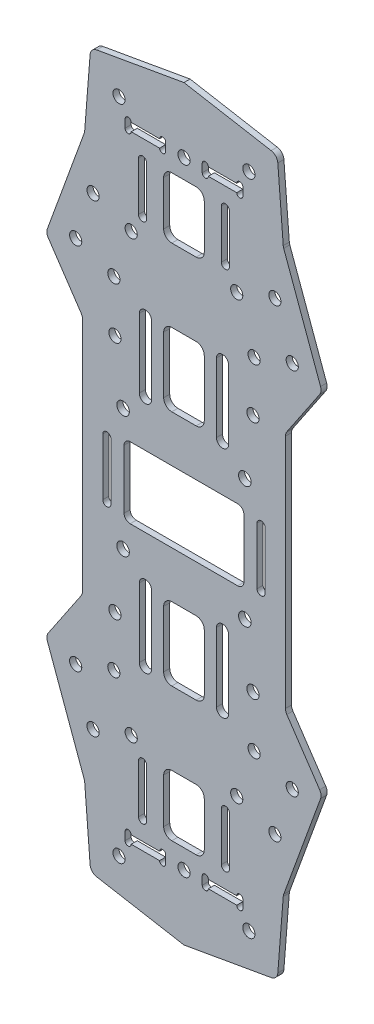
from build123d import *

# Parameters (mm, degrees)
SKETCH1_R           = 1.5
BOTTOM_PLATE_DEPTH  = 1.5
SKETCH2_R           = 1.5
BOSS_EXTRUDE2_DEPTH = 1.5
CUT_EXTRUDE1_REACH  = 100.014
SKETCH4_R           = 1.55


with BuildPart() as part:
    # Sketch1 → bottom-plate (new body)
    with BuildSketch(Plane.XY):
        with BuildLine():
            Line((-24.571418021, 68.904816085), (-33.651464065, 43.95759461))
            ThreePointArc((-33.651464065, 43.95759461), (-33.757171127, 43.029815637), (-33.430153969, 42.155168516))
            Line((-33.430153969, 42.155168516), (-25.341924855, 30.163875727))
            ThreePointArc((-25.341924855, 30.163875727), (-25.087390488, 29.63023333), (-25, 29.04548992))
            Line((-25, 29.04548992), (-25, -29.04548992))
            ThreePointArc((-25, -29.04548992), (-25.087390488, -29.63023333), (-25.341924855, -30.163875727))
            Line((-25.341924855, -30.163875727), (-33.430153969, -42.155168516))
            ThreePointArc((-33.430153969, -42.155168516), (-33.757171127, -43.029815637), (-33.651464065, -43.95759461))
            Line((-33.651464065, -43.95759461), (-24.571418021, -68.904816085))
            ThreePointArc((-24.571418021, -68.904816085), (-24.49634105, -69.164501027), (-24.456968595, -69.43193818))
            Line((-24.456968595, -69.43193818), (-23.121499045, -86.400687699))
            ThreePointArc((-23.121499045, -86.400687699), (-22.608100633, -87.588503122), (-21.474960733, -88.213385013))
            Line((-21.474960733, -88.213385013), (0, -92))
            Line((0, -92), (21.474960733, -88.213385013))
            ThreePointArc((21.474960733, -88.213385013), (22.608100633, -87.588503122), (23.121499045, -86.400687699))
            Line((23.121499045, -86.400687699), (24.456968595, -69.43193818))
            ThreePointArc((24.456968595, -69.43193818), (24.49634105, -69.164501027), (24.571418021, -68.904816085))
            Line((24.571418021, -68.904816085), (33.651464065, -43.95759461))
            ThreePointArc((33.651464065, -43.95759461), (33.757171127, -43.029815637), (33.430153969, -42.155168516))
            Line((33.430153969, -42.155168516), (25.341924855, -30.163875727))
            ThreePointArc((25.341924855, -30.163875727), (25.087390488, -29.63023333), (25, -29.04548992))
            Line((25, -29.04548992), (25, 29.04548992))
            ThreePointArc((25, 29.04548992), (25.087390488, 29.63023333), (25.341924855, 30.163875727))
            Line((25.341924855, 30.163875727), (33.430153969, 42.155168516))
            ThreePointArc((33.430153969, 42.155168516), (33.757171127, 43.029815637), (33.651464065, 43.95759461))
            Line((33.651464065, 43.95759461), (24.571418021, 68.904816085))
            ThreePointArc((24.571418021, 68.904816085), (24.49634105, 69.164501027), (24.456968595, 69.43193818))
            Line((24.456968595, 69.43193818), (23.121499045, 86.400687699))
            ThreePointArc((23.121499045, 86.400687699), (22.608100633, 87.588503122), (21.474960733, 88.213385013))
            Line((21.474960733, 88.213385013), (0, 92))
            Line((0, 92), (-21.474960733, 88.213385013))
            ThreePointArc((-21.474960733, 88.213385013), (-22.608100633, 87.588503122), (-23.121499045, 86.400687699))
            Line((-23.121499045, 86.400687699), (-24.456968595, 69.43193818))
            ThreePointArc((-24.456968595, 69.43193818), (-24.49634105, 69.164501027), (-24.571418021, 68.904816085))
        make_face()
        with Locations(Location((-16, 81, 0), (0, 0, 180))):
            Circle(SKETCH1_R, mode=Mode.SUBTRACT)
        with Locations(Location((0, 76, 0), (0, 0, 180))):
            Circle(SKETCH1_R, mode=Mode.SUBTRACT)
        with Locations(Location((-26.672177999, 45.420201433, 0), (0, 0, 180))):
            Circle(SKETCH1_R, mode=Mode.SUBTRACT)
        with Locations(Location((-22.396926208, 57.166359193, 0), (0, 0, 180))):
            Circle(SKETCH1_R, mode=Mode.SUBTRACT)
        with Locations(Location((-17.275251792, 42, 0), (0, 0, 180))):
            Circle(SKETCH1_R, mode=Mode.SUBTRACT)
        with Locations(Location((-13, 53.74615776, 0), (0, 0, 180))):
            Circle(SKETCH1_R, mode=Mode.SUBTRACT)
        with Locations(Location((-17, 29.5, 0), (0, 0, 180))):
            Circle(SKETCH1_R, mode=Mode.SUBTRACT)
        with Locations(Location((-15.25, 15.25, 0), (0, 0, 180))):
            Circle(SKETCH1_R, mode=Mode.SUBTRACT)
        with Locations(Location((15.25, 15.25, 0), (0, 0, 180))):
            Circle(SKETCH1_R, mode=Mode.SUBTRACT)
        with Locations(Location((17, 29.5, 0), (0, 0, 180))):
            Circle(SKETCH1_R, mode=Mode.SUBTRACT)
        with Locations(Location((13, 53.74615776, 0), (0, 0, 180))):
            Circle(SKETCH1_R, mode=Mode.SUBTRACT)
        with Locations(Location((17.275251792, 42, 0), (0, 0, 180))):
            Circle(SKETCH1_R, mode=Mode.SUBTRACT)
        with Locations(Location((22.396926208, 57.166359193, 0), (0, 0, 180))):
            Circle(SKETCH1_R, mode=Mode.SUBTRACT)
        with Locations(Location((26.672177999, 45.420201433, 0), (0, 0, 180))):
            Circle(SKETCH1_R, mode=Mode.SUBTRACT)
        with Locations(Location((16, 81, 0), (0, 0, 180))):
            Circle(SKETCH1_R, mode=Mode.SUBTRACT)
        with Locations(Location((16, -81, 0), (0, 0, 180))):
            Circle(SKETCH1_R, mode=Mode.SUBTRACT)
        with Locations(Location((26.672177999, -45.420201433, 0), (0, 0, 180))):
            Circle(SKETCH1_R, mode=Mode.SUBTRACT)
        with Locations(Location((22.396926208, -57.166359193, 0), (0, 0, 180))):
            Circle(SKETCH1_R, mode=Mode.SUBTRACT)
        with Locations(Location((17.275251792, -42, 0), (0, 0, 180))):
            Circle(SKETCH1_R, mode=Mode.SUBTRACT)
        with Locations(Location((13, -53.74615776, 0), (0, 0, 180))):
            Circle(SKETCH1_R, mode=Mode.SUBTRACT)
        with Locations(Location((17, -29.5, 0), (0, 0, 180))):
            Circle(SKETCH1_R, mode=Mode.SUBTRACT)
        with Locations(Location((15.25, -15.25, 0), (0, 0, 180))):
            Circle(SKETCH1_R, mode=Mode.SUBTRACT)
        with Locations(Location((-15.25, -15.25, 0), (0, 0, 180))):
            Circle(SKETCH1_R, mode=Mode.SUBTRACT)
        with Locations(Location((-17, -29.5, 0), (0, 0, 180))):
            Circle(SKETCH1_R, mode=Mode.SUBTRACT)
        with Locations(Location((-13, -53.74615776, 0), (0, 0, 180))):
            Circle(SKETCH1_R, mode=Mode.SUBTRACT)
        with Locations(Location((-17.275251792, -42, 0), (0, 0, 180))):
            Circle(SKETCH1_R, mode=Mode.SUBTRACT)
        with Locations(Location((-22.396926208, -57.166359193, 0), (0, 0, 180))):
            Circle(SKETCH1_R, mode=Mode.SUBTRACT)
        with Locations(Location((-26.672177999, -45.420201433, 0), (0, 0, 180))):
            Circle(SKETCH1_R, mode=Mode.SUBTRACT)
        with Locations(Location((0, -76, 0), (0, 0, 180))):
            Circle(SKETCH1_R, mode=Mode.SUBTRACT)
        with Locations(Location((-16, -81, 0), (0, 0, 180))):
            Circle(SKETCH1_R, mode=Mode.SUBTRACT)
        with BuildLine():
            Line((20, 7), (20, -7))
            ThreePointArc((20, -7), (19, -8), (18, -7))
            Line((18, -7), (18, 7))
            ThreePointArc((18, 7), (19, 8), (20, 7))
        make_face(mode=Mode.SUBTRACT)
        with BuildLine():
            Line((-18, 7), (-18, -7))
            ThreePointArc((-18, -7), (-19, -8), (-20, -7))
            Line((-20, -7), (-20, 7))
            ThreePointArc((-20, 7), (-19, 8), (-18, 7))
        make_face(mode=Mode.SUBTRACT)
        with BuildLine():
            Line((-11.2, -70.25), (-11.2, -58.25))
            ThreePointArc((-11.2, -58.25), (-10.2, -57.25), (-9.2, -58.25))
            Line((-9.2, -58.25), (-9.2, -70.25))
            ThreePointArc((-9.2, -70.25), (-10.2, -71.25), (-11.2, -70.25))
        make_face(mode=Mode.SUBTRACT)
        with BuildLine():
            Line((-11, -37.25), (-11, -20.25))
            ThreePointArc((-11, -20.25), (-9.5, -18.75), (-8, -20.25))
            Line((-8, -20.25), (-8, -37.25))
            ThreePointArc((-8, -37.25), (-9.5, -38.75), (-11, -37.25))
        make_face(mode=Mode.SUBTRACT)
        with BuildLine():
            Line((8, -37.25), (8, -20.25))
            ThreePointArc((8, -20.25), (9.5, -18.75), (11, -20.25))
            Line((11, -20.25), (11, -37.25))
            ThreePointArc((11, -37.25), (9.5, -38.75), (8, -37.25))
        make_face(mode=Mode.SUBTRACT)
        with BuildLine():
            Line((9.2, -70.25), (9.2, -58.25))
            ThreePointArc((9.2, -58.25), (10.2, -57.25), (11.2, -58.25))
            Line((11.2, -58.25), (11.2, -70.25))
            ThreePointArc((11.2, -70.25), (10.2, -71.25), (9.2, -70.25))
        make_face(mode=Mode.SUBTRACT)
        with BuildLine():
            Line((-3, -20.25), (3, -20.25))
            ThreePointArc((3, -20.25), (4.414213562, -20.835786438), (5, -22.25))
            Line((5, -22.25), (5, -36.25))
            ThreePointArc((5, -36.25), (4.414213562, -37.664213562), (3, -38.25))
            Line((3, -38.25), (-3, -38.25))
            ThreePointArc((-3, -38.25), (-4.414213562, -37.664213562), (-5, -36.25))
            Line((-5, -36.25), (-5, -22.25))
            ThreePointArc((-5, -22.25), (-4.414213562, -20.835786438), (-3, -20.25))
        make_face(mode=Mode.SUBTRACT)
        with BuildLine():
            Line((5, -58.25), (5, -69.25))
            ThreePointArc((5, -69.25), (4.414213562, -70.664213562), (3, -71.25))
            Line((3, -71.25), (-3, -71.25))
            ThreePointArc((-3, -71.25), (-4.414213562, -70.664213562), (-5, -69.25))
            Line((-5, -69.25), (-5, -58.25))
            ThreePointArc((-5, -58.25), (-4.414213562, -56.835786438), (-3, -56.25))
            Line((-3, -56.25), (3, -56.25))
            ThreePointArc((3, -56.25), (4.414213562, -56.835786438), (5, -58.25))
        make_face(mode=Mode.SUBTRACT)
        with BuildLine():
            Line((11.2, 70.25), (11.2, 58.25))
            ThreePointArc((11.2, 58.25), (10.2, 57.25), (9.2, 58.25))
            Line((9.2, 58.25), (9.2, 70.25))
            ThreePointArc((9.2, 70.25), (10.2, 71.25), (11.2, 70.25))
        make_face(mode=Mode.SUBTRACT)
        with BuildLine():
            Line((11, 37.25), (11, 20.25))
            ThreePointArc((11, 20.25), (9.5, 18.75), (8, 20.25))
            Line((8, 20.25), (8, 37.25))
            ThreePointArc((8, 37.25), (9.5, 38.75), (11, 37.25))
        make_face(mode=Mode.SUBTRACT)
        with BuildLine():
            Line((-8, 37.25), (-8, 20.25))
            ThreePointArc((-8, 20.25), (-9.5, 18.75), (-11, 20.25))
            Line((-11, 20.25), (-11, 37.25))
            ThreePointArc((-11, 37.25), (-9.5, 38.75), (-8, 37.25))
        make_face(mode=Mode.SUBTRACT)
        with BuildLine():
            Line((-9.2, 70.25), (-9.2, 58.25))
            ThreePointArc((-9.2, 58.25), (-10.2, 57.25), (-11.2, 58.25))
            Line((-11.2, 58.25), (-11.2, 70.25))
            ThreePointArc((-11.2, 70.25), (-10.2, 71.25), (-9.2, 70.25))
        make_face(mode=Mode.SUBTRACT)
        with BuildLine():
            Line((13.25, -8.75), (-13.25, -8.75))
            ThreePointArc((-13.25, -8.75), (-14.310660172, -8.310660172), (-14.75, -7.25))
            Line((-14.75, -7.25), (-14.75, 7.25))
            ThreePointArc((-14.75, 7.25), (-14.310660172, 8.310660172), (-13.25, 8.75))
            Line((-13.25, 8.75), (13.25, 8.75))
            ThreePointArc((13.25, 8.75), (14.310660172, 8.310660172), (14.75, 7.25))
            Line((14.75, 7.25), (14.75, -7.25))
            ThreePointArc((14.75, -7.25), (14.310660172, -8.310660172), (13.25, -8.75))
        make_face(mode=Mode.SUBTRACT)
        with BuildLine():
            Line((-5, 58.25), (-5, 69.25))
            ThreePointArc((-5, 69.25), (-4.414213562, 70.664213562), (-3, 71.25))
            Line((-3, 71.25), (3, 71.25))
            ThreePointArc((3, 71.25), (4.414213562, 70.664213562), (5, 69.25))
            Line((5, 69.25), (5, 58.25))
            ThreePointArc((5, 58.25), (4.414213562, 56.835786438), (3, 56.25))
            Line((3, 56.25), (-3, 56.25))
            ThreePointArc((-3, 56.25), (-4.414213562, 56.835786438), (-5, 58.25))
        make_face(mode=Mode.SUBTRACT)
        with BuildLine():
            Line((-3, 38.25), (3, 38.25))
            ThreePointArc((3, 38.25), (4.414213562, 37.664213562), (5, 36.25))
            Line((5, 36.25), (5, 22.25))
            ThreePointArc((5, 22.25), (4.414213562, 20.835786438), (3, 20.25))
            Line((3, 20.25), (-3, 20.25))
            ThreePointArc((-3, 20.25), (-4.414213562, 20.835786438), (-5, 22.25))
            Line((-5, 22.25), (-5, 36.25))
            ThreePointArc((-5, 36.25), (-4.414213562, 37.664213562), (-3, 38.25))
        make_face(mode=Mode.SUBTRACT)
        with BuildLine():
            Line((-14.5, 75), (-14.5, 77))
            ThreePointArc((-14.5, 77), (-13.75, 77.75), (-13, 77))
            Line((-13, 77), (-6, 77))
            ThreePointArc((-6, 77), (-5.25, 77.75), (-4.5, 77))
            Line((-4.5, 77), (-4.5, 75))
            ThreePointArc((-4.5, 75), (-5.25, 74.25), (-6, 75))
            Line((-6, 75), (-13, 75))
            ThreePointArc((-13, 75), (-13.75, 74.25), (-14.5, 75))
        make_face(mode=Mode.SUBTRACT)
        with BuildLine():
            Line((6, 77), (13, 77))
            ThreePointArc((13, 77), (13.75, 77.75), (14.5, 77))
            Line((14.5, 77), (14.5, 75))
            ThreePointArc((14.5, 75), (13.75, 74.25), (13, 75))
            Line((13, 75), (6, 75))
            ThreePointArc((6, 75), (5.25, 74.25), (4.5, 75))
            Line((4.5, 75), (4.5, 77))
            ThreePointArc((4.5, 77), (5.25, 77.75), (6, 77))
        make_face(mode=Mode.SUBTRACT)
        with BuildLine():
            Line((13, -77), (6, -77))
            ThreePointArc((6, -77), (5.25, -77.75), (4.5, -77))
            Line((4.5, -77), (4.5, -75))
            ThreePointArc((4.5, -75), (5.25, -74.25), (6, -75))
            Line((6, -75), (13, -75))
            ThreePointArc((13, -75), (13.75, -74.25), (14.5, -75))
            Line((14.5, -75), (14.5, -77))
            ThreePointArc((14.5, -77), (13.75, -77.75), (13, -77))
        make_face(mode=Mode.SUBTRACT)
        with BuildLine():
            Line((-6, -77), (-13, -77))
            ThreePointArc((-13, -77), (-13.75, -77.75), (-14.5, -77))
            Line((-14.5, -77), (-14.5, -75))
            ThreePointArc((-14.5, -75), (-13.75, -74.25), (-13, -75))
            Line((-13, -75), (-6, -75))
            ThreePointArc((-6, -75), (-5.25, -74.25), (-4.5, -75))
            Line((-4.5, -75), (-4.5, -77))
            ThreePointArc((-4.5, -77), (-5.25, -77.75), (-6, -77))
        make_face(mode=Mode.SUBTRACT)
    extrude(amount=-BOTTOM_PLATE_DEPTH)

    # Sketch2 → Boss-Extrude2 (add)
    with BuildSketch(Plane.XY):
        with Locations((-15.25, 15.25)):
            Circle(SKETCH2_R)
        with Locations((15.25, 15.25)):
            Circle(SKETCH2_R)
        with Locations((-15.25, -15.25)):
            Circle(SKETCH2_R)
        with Locations((15.25, -15.25)):
            Circle(SKETCH2_R)
    extrude(amount=-BOSS_EXTRUDE2_DEPTH)

    # Sketch4 → Cut-Extrude1 (cut, up to next)
    with BuildSketch(Plane.XY, mode=Mode.PRIVATE) as cut_extrude1_sk1:
        with Locations((-15, 15)):
            Circle(SKETCH4_R)
    cut_extrude1_tool1 = extrude(cut_extrude1_sk1.sketch, amount=-CUT_EXTRUDE1_REACH, mode=Mode.PRIVATE) & part.part
    # Sketch4 → Cut-Extrude1 (cut, up to next)
    with BuildSketch(Plane.XY, mode=Mode.PRIVATE) as cut_extrude1_sk2:
        with Locations((15, 15)):
            Circle(SKETCH4_R)
    cut_extrude1_tool2 = extrude(cut_extrude1_sk2.sketch, amount=-CUT_EXTRUDE1_REACH, mode=Mode.PRIVATE) & part.part
    # Sketch4 → Cut-Extrude1 (cut, up to next)
    with BuildSketch(Plane.XY, mode=Mode.PRIVATE) as cut_extrude1_sk3:
        with Locations((15, -15)):
            Circle(SKETCH4_R)
    cut_extrude1_tool3 = extrude(cut_extrude1_sk3.sketch, amount=-CUT_EXTRUDE1_REACH, mode=Mode.PRIVATE) & part.part
    # Sketch4 → Cut-Extrude1 (cut, up to next)
    with BuildSketch(Plane.XY, mode=Mode.PRIVATE) as cut_extrude1_sk4:
        with Locations((-15, -15)):
            Circle(SKETCH4_R)
    cut_extrude1_tool4 = extrude(cut_extrude1_sk4.sketch, amount=-CUT_EXTRUDE1_REACH, mode=Mode.PRIVATE) & part.part
    add(cut_extrude1_tool1.solids().sort_by_distance((-15, 15, 0))[0], mode=Mode.SUBTRACT)
    add(cut_extrude1_tool2.solids().sort_by_distance((15, 15, 0))[0], mode=Mode.SUBTRACT)
    add(cut_extrude1_tool3.solids().sort_by_distance((15, -15, 0))[0], mode=Mode.SUBTRACT)
    add(cut_extrude1_tool4.solids().sort_by_distance((-15, -15, 0))[0], mode=Mode.SUBTRACT)


solid = part.part
